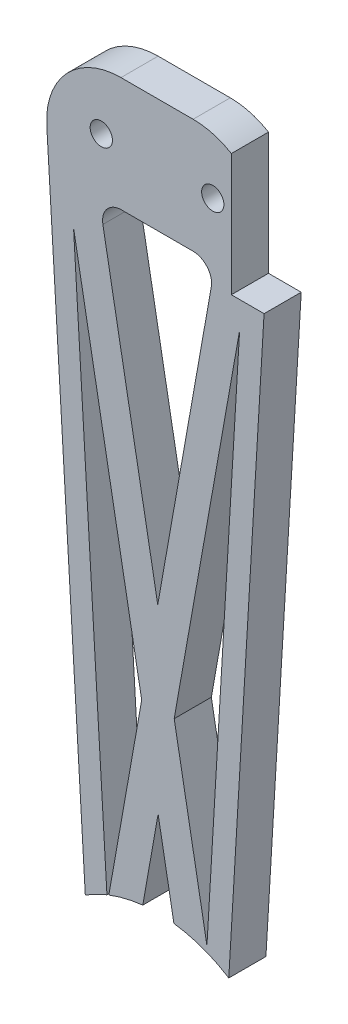
from build123d import *

# Parameters (mm, degrees)
SKETCH1_R           = 3
BOSS_EXTRUDE2_DEPTH = 10
FILLET1_R           = 20
FILLET2_R           = 20
CUT_EXTRUDE1_START  = -10
CUT_EXTRUDE1_DEPTH  = 10
FILLET3_R           = 5
CUT_EXTRUDE5_START  = -10
SKETCH5_W           = 12
SKETCH5_H           = 10
CUT_EXTRUDE5_DEPTH  = 10


with BuildPart() as part:
    # Sketch1 → Boss-Extrude2 (new body)
    with BuildSketch(Plane.XY):
        with BuildLine():
            Line((-30, 15.770412854), (-30, 0))
            Line((-30, 0), (-17.5, -210))
            ThreePointArc((-17.5, -210), (0, -227.5), (17.5, -210))
            Line((17.5, -210), (30, 0))
            Line((30, 0), (30, 15.770412854))
            Line((30, 15.770412854), (-30, 15.770412854))
        make_face()
        with Locations((-15, 0)):
            Circle(SKETCH1_R, mode=Mode.SUBTRACT)
        with Locations((15, 0)):
            Circle(SKETCH1_R, mode=Mode.SUBTRACT)
        Polygon((0, -205), (6, -205), (6, -215), (-6, -215), (-6, -205), align=None, mode=Mode.SUBTRACT)
    extrude(amount=BOSS_EXTRUDE2_DEPTH)

    # Fillet1
    fillet1_edges = [part.edges().sort_by_distance(p)[0] for p in [
        (-30, 15.770412854, 5),
    ]]
    fillet(fillet1_edges, radius=FILLET1_R)

    # Fillet2
    fillet2_edges = [part.edges().sort_by_distance(p)[0] for p in [
        (30, 15.770412854, 5),
    ]]
    fillet(fillet2_edges, radius=FILLET2_R)

    # Sketch4 → Cut-Extrude1 (cut)
    with BuildSketch(Plane.XY.offset(10).offset(CUT_EXTRUDE1_START)):
        Polygon((-15.651797422, -15), (0.190220551, -102.160979768), (15.643622882, -15), (15, -15), align=None)
        Polygon((-22.473027071, -25.6531452), (-13.367328465, -178.628881795), (-4.134156204, -126.551525408), align=None)
        Polygon((22.230419841, -27.161313899), (4.615986353, -126.511039477), (13.430162671, -175.005634359), align=None)
        with BuildLine():
            Line((0.291609598, -150.901585116), (-7.372445375, -194.128735111))
            ThreePointArc((-7.372445375, -194.128735111), (0.476576628, -192.506490497), (8.225632191, -194.553674383))
            Line((8.225632191, -194.553674383), (0.291609598, -150.901585116))
        make_face()
    extrude(amount=CUT_EXTRUDE1_DEPTH, mode=Mode.SUBTRACT)

    # Fillet3
    fillet3_edges = [part.edges().sort_by_distance(p)[0] for p in [
        (8.225632191, -194.553674383, 5),
        (-7.372445375, -194.128735111, 5),
        (-15.651797422, -15, 5),
        (15.643622882, -15, 5),
    ]]
    fillet(fillet3_edges, radius=FILLET3_R)

    # Sketch5 → Cut-Extrude5 (cut)
    # profile 1 of 10: a face of its own
    with BuildSketch(Plane.XY.offset(10).offset(CUT_EXTRUDE5_START)):
        with BuildLine():
            Line((29.260488635, 0), (20, 0))
            Line((20, 0), (20, -20))
            Line((20, -20), (28.80952381, -20))
            Line((28.80952381, -20), (29.677502384, -5.417959945))
            ThreePointArc((29.677502384, -5.417959945), (29.653859351, -2.694751229), (29.260488635, 0))
        make_face()
    # profile 2 of 10: a face of its own
    with BuildSketch(Plane.XY.offset(10).offset(CUT_EXTRUDE5_START)):
        with BuildLine():
            Line((20, 12.921923742), (20, 0))
            Line((20, 0), (29.260488635, 0))
            ThreePointArc((29.260488635, 0), (25.96931496, 7.420606017), (20, 12.921923742))
        make_face()
    # profile 3 of 10: a face of its own
    with BuildSketch(Plane.XY.offset(10).offset(CUT_EXTRUDE5_START)):
        with BuildLine():
            Line((4.816305425, -175.795946561), (11.228656567, -175.795946561))
            ThreePointArc((11.228656567, -175.795946561), (7.921392788, -174.882318751), (4.542172021, -174.287695771))
            Line((4.542172021, -174.287695771), (4.816305425, -175.795946561))
        make_face()
    # profile 4 of 10: a face of its own
    with BuildSketch(Plane.XY.offset(10).offset(CUT_EXTRUDE5_START)):
        with BuildLine():
            ThreePointArc((19.308563513, -179.61613298), (15.387621929, -177.454323), (11.228656567, -175.795946561))
            Line((11.228656567, -175.795946561), (4.816305425, -175.795946561))
            Line((4.816305425, -175.795946561), (4.879901452, -176.145844664))
            ThreePointArc((4.879901452, -176.145844664), (12.347146855, -178.102269105), (19.185515511, -181.683339422))
            Line((19.185515511, -181.683339422), (19.308563513, -179.61613298))
        make_face()
    # profile 5 of 10: a face of its own
    with BuildSketch(Plane.XY.offset(10).offset(CUT_EXTRUDE5_START)):
        with BuildLine():
            Line((18.887385797, -186.691918617), (19.185515511, -181.683339422))
            ThreePointArc((19.185515511, -181.683339422), (12.347146855, -178.102269105), (4.879901452, -176.145844664))
            Line((4.879901452, -176.145844664), (5.679005105, -180.54242201))
            ThreePointArc((5.679005105, -180.54242201), (12.662186526, -182.803142969), (18.887385797, -186.691918617))
        make_face()
    # profile 6 of 10: a face of its own
    with BuildSketch(Plane.XY.offset(10).offset(CUT_EXTRUDE5_START)):
        with BuildLine():
            Line((17.5, -210), (18.887385797, -186.691918617))
            ThreePointArc((18.887385797, -186.691918617), (12.662186526, -182.803142969), (5.679005105, -180.54242201))
            Line((5.679005105, -180.54242201), (6.795310384, -186.684206595))
            ThreePointArc((6.795310384, -186.684206595), (5.577551358, -190.939561161), (1.45903868, -192.560928748))
            ThreePointArc((1.45903868, -192.560928748), (0.292984986, -192.502452749), (-0.874372768, -192.521857299))
            ThreePointArc((-0.874372768, -192.521857299), (-4.874459747, -190.834989527), (-6.047413252, -186.655228912))
            Line((-6.047413252, -186.655228912), (-4.940068564, -180.409533248))
            ThreePointArc((-4.940068564, -180.409533248), (-12.320876057, -182.646828096), (-18.887385797, -186.691918617))
            Line((-18.887385797, -186.691918617), (-17.5, -210))
            ThreePointArc((-17.5, -210), (0, -227.5), (17.5, -210))
        make_face()
        with Locations((0, -210)):
            Rectangle(SKETCH5_W, SKETCH5_H, mode=Mode.SUBTRACT)
    # profile 7 of 10: a face of its own
    with BuildSketch(Plane.XY.offset(10).offset(CUT_EXTRUDE5_START)):
        with BuildLine():
            Line((-4.167269409, -176.050756454), (-4.122092315, -175.795946561))
            Line((-4.122092315, -175.795946561), (-11.228656567, -175.795946561))
            ThreePointArc((-11.228656567, -175.795946561), (-12.106175916, -176.096600396), (-12.975657802, -176.419763184))
            Line((-12.975657802, -176.419763184), (-13.345719148, -178.506999951))
            ThreePointArc((-13.345719148, -178.506999951), (-8.842198544, -176.958619935), (-4.167269409, -176.050756454))
        make_face()
    # profile 8 of 10: a face of its own
    with BuildSketch(Plane.XY.offset(10).offset(CUT_EXTRUDE5_START)):
        with BuildLine():
            Line((-4.122092315, -175.795946561), (-3.840092025, -174.205395752))
            ThreePointArc((-3.840092025, -174.205395752), (-7.576229867, -174.806240028), (-11.228656567, -175.795946561))
            Line((-11.228656567, -175.795946561), (-4.122092315, -175.795946561))
        make_face()
    # profile 9 of 10: a face of its own
    with BuildSketch(Plane.XY.offset(10).offset(CUT_EXTRUDE5_START)):
        with BuildLine():
            ThreePointArc((-13.486799408, -176.621769943), (-16.46588928, -177.986339006), (-19.308563513, -179.61613298))
            Line((-19.308563513, -179.61613298), (-19.185515511, -181.683339422))
            ThreePointArc((-19.185515511, -181.683339422), (-16.356398794, -179.96026814), (-13.373872309, -178.518945203))
            Line((-13.373872309, -178.518945203), (-13.486799408, -176.621769943))
        make_face()
    # profile 10 of 10: a face of its own
    with BuildSketch(Plane.XY.offset(10).offset(CUT_EXTRUDE5_START)):
        with BuildLine():
            Line((-4.940068564, -180.409533248), (-4.167269409, -176.050756454))
            ThreePointArc((-4.167269409, -176.050756454), (-8.842198544, -176.958619935), (-13.345719148, -178.506999951))
            Line((-13.345719148, -178.506999951), (-13.367328465, -178.628881795))
            Line((-13.367328465, -178.628881795), (-13.373872309, -178.518945203))
            ThreePointArc((-13.373872309, -178.518945203), (-16.356398794, -179.96026814), (-19.185515511, -181.683339422))
            Line((-19.185515511, -181.683339422), (-18.887385797, -186.691918617))
            ThreePointArc((-18.887385797, -186.691918617), (-12.320876057, -182.646828096), (-4.940068564, -180.409533248))
        make_face()
    extrude(amount=CUT_EXTRUDE5_DEPTH, mode=Mode.SUBTRACT)


solid = part.part
